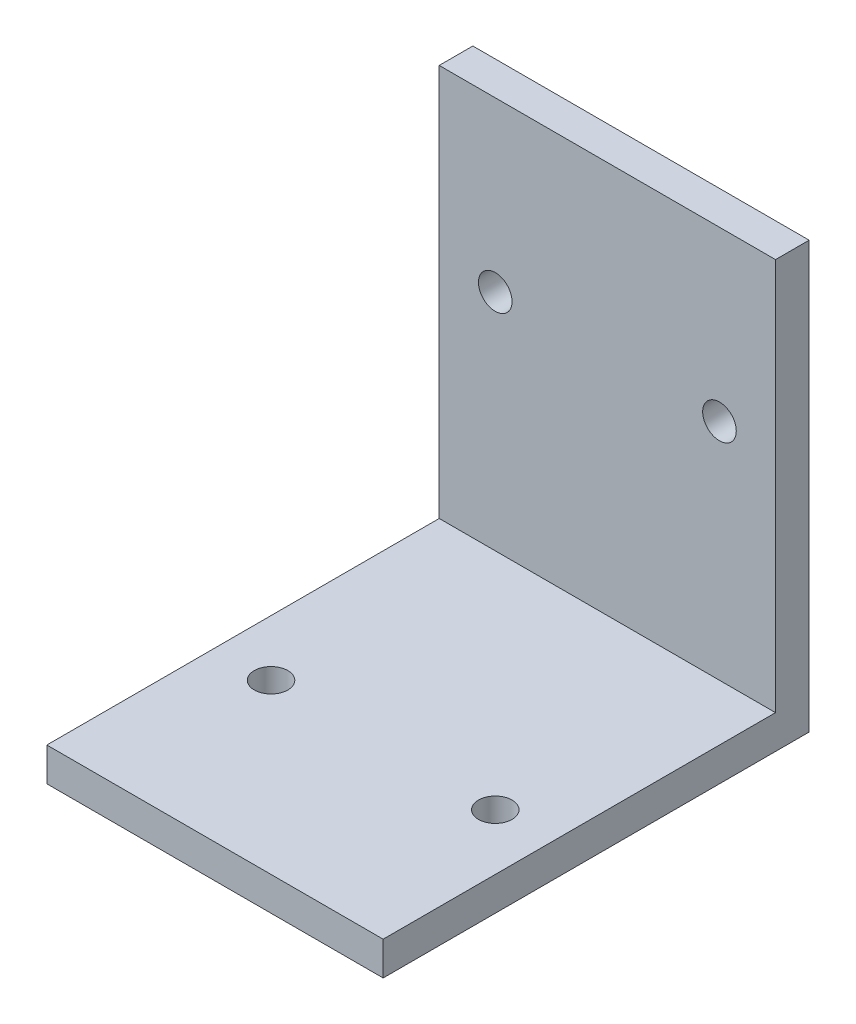
from build123d import *

# Parameters (mm, degrees)
SKETCH_1_W          = 30
SKETCH_1_H          = 38
EXTRUDE_1_DEPTH     = 3
SKETCH_2_W          = 30
SKETCH_2_H          = 3
EXTRUDE_2_DEPTH     = 35
SKETCH_3_R          = 1.5
CUT_EXTRUDE_1_DEPTH = 35
SKETCH_4_R          = 1.5
CUT_EXTRUDE_2_DEPTH = 35


with BuildPart() as part:
    # 草图1 → 凸台-拉伸1 (new body)
    with BuildSketch(Plane.XY):
        Rectangle(SKETCH_1_W, SKETCH_1_H)
    extrude(amount=EXTRUDE_1_DEPTH)

    # 草图2 → 凸台-拉伸2 (add)
    with BuildSketch(Plane.XY.offset(3)):
        with Locations((0, -17.5)):
            Rectangle(SKETCH_2_W, SKETCH_2_H)
    extrude(amount=EXTRUDE_2_DEPTH)

    # 草图3 → 切除-拉伸1 (cut)
    with BuildSketch(Plane.XY.offset(3)):
        with Locations((-10, 4)):
            Circle(SKETCH_3_R)
        with Locations((10, 4)):
            Circle(SKETCH_3_R)
    extrude(amount=-CUT_EXTRUDE_1_DEPTH, mode=Mode.SUBTRACT)

    # 草图4 → 切除-拉伸2 (cut)
    with BuildSketch(Plane(origin=(0, -16, 0), x_dir=(1, 0, 0), z_dir=(0, 1, 0))):
        with Locations(Location((-10, -23, 0), (0, 0, 270))):
            Circle(SKETCH_4_R)
        with Locations(Location((10, -23, 0), (0, 0, 270))):
            Circle(SKETCH_4_R)
    extrude(amount=-CUT_EXTRUDE_2_DEPTH, mode=Mode.SUBTRACT)


solid = part.part
